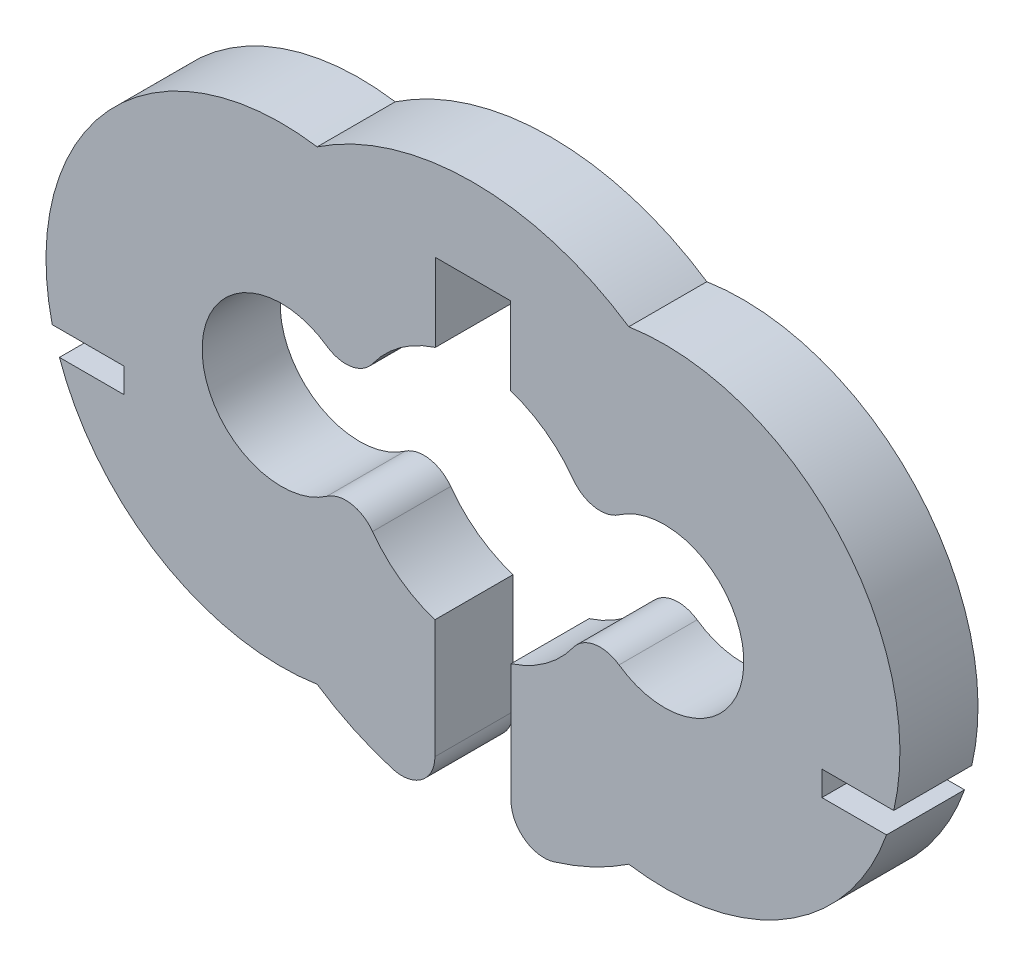
from build123d import *

# Parameters (mm, degrees)
EXTRUDE_1_DEPTH     = 3
SKETCH_2_W          = 3
SKETCH_2_H          = 0.95
CUT_EXTRUDE_1_DEPTH = 3
FILLET_1_R          = 1.27


with BuildPart() as part:
    # 스케치1 → 보스-돌출1 (new body)
    with BuildSketch(Plane.XY):
        with BuildLine():
            Line((-1.4475, 7.537196271), (1.4475, 7.537196271))
            Line((1.4475, 7.537196271), (1.4475, 4.537196271))
            ThreePointArc((1.4475, 4.537196271), (3.432437621, 3.301481217), (4.590044254, 1.27))
            ThreePointArc((4.590044254, 1.27), (10.408857131, 0), (4.590044254, -1.27))
            ThreePointArc((4.590044254, -1.27), (3.437893174, -3.295799869), (1.4625, -4.532383479))
            Line((1.4625, -4.532383479), (1.4625, -10.662668522))
            ThreePointArc((1.4625, -10.662668522), (3.822964303, -10.060633687), (5.987571718, -8.943175676))
            ThreePointArc((5.987571718, -8.943175676), (16.408857131, 0), (5.987571718, 8.943175676))
            ThreePointArc((5.987571718, 8.943175676), (0, 10.7625), (-5.987571718, 8.943175676))
            ThreePointArc((-5.987571718, 8.943175676), (-16.408857131, 0), (-5.987571718, -8.943175676))
            ThreePointArc((-5.987571718, -8.943175676), (-3.822964303, -10.060633687), (-1.4625, -10.662668522))
            Line((-1.4625, -10.662668522), (-1.4625, -4.532383479))
            ThreePointArc((-1.4625, -4.532383479), (-3.437893174, -3.295799869), (-4.590044254, -1.27))
            ThreePointArc((-4.590044254, -1.27), (-10.408857131, 0), (-4.590044254, 1.27))
            ThreePointArc((-4.590044254, 1.27), (-3.432437621, 3.301481217), (-1.4475, 4.537196271))
            Line((-1.4475, 4.537196271), (-1.4475, 7.537196271))
        make_face()
    extrude(amount=EXTRUDE_1_DEPTH)

    # 스케치2 → 컷-돌출1 (cut)
    with BuildSketch(Plane.XY.offset(3)):
        with Locations((14.908857131, -2.54)):
            Rectangle(SKETCH_2_W, SKETCH_2_H)
        with Locations((-14.908857131, -2.54)):
            Rectangle(SKETCH_2_W, SKETCH_2_H)
    extrude(amount=-CUT_EXTRUDE_1_DEPTH, mode=Mode.SUBTRACT)

    # 필렛1
    fillet_1_edges = [part.edges().sort_by_distance(p)[0] for p in [
        (-4.590044254, 1.27, 1.5),
        (-4.590044254, -1.27, 1.5),
        (-1.4625, -10.662668522, 1.5),
        (1.4625, -10.662668522, 1.5),
        (4.590044254, -1.27, 1.5),
        (4.590044254, 1.27, 1.5),
    ]]
    fillet(fillet_1_edges, radius=FILLET_1_R)


solid = part.part
